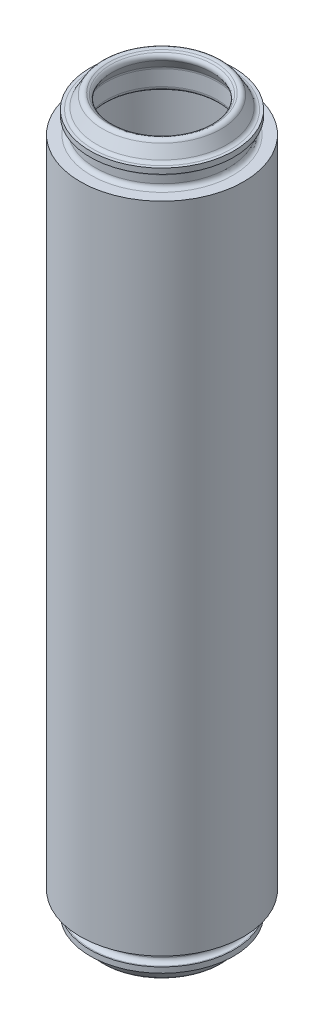
from build123d import *

# Parameters (mm, degrees)
SKETCH1_R           = 7.5
BOSS_EXTRUDE1_DEPTH = 30
SKETCH2_R           = 6.5
CUT_EXTRUDE1_DEPTH  = 8.5


with BuildPart() as part:
    # Sketch1 → Boss-Extrude1 (new body)
    with BuildSketch(Plane(origin=(0, 0, 0), x_dir=(1, 0, 0), z_dir=(0, 1, 0))):
        with Locations(Location((0, 0, 0), (0, 0, 270))):
            Circle(SKETCH1_R)
    boss_extrude1 = extrude(amount=BOSS_EXTRUDE1_DEPTH)

    # Sketch2 → Cut-Extrude1 (cut)
    with BuildSketch(Plane(origin=(0, 30, 0), x_dir=(1, 0, 0), z_dir=(0, 1, 0))):
        with Locations(Location((0, 0, 0), (0, 0, 270))):
            Circle(SKETCH2_R)
    cut_extrude1 = extrude(amount=-CUT_EXTRUDE1_DEPTH, mode=Mode.SUBTRACT)

    # Sketch3 → Revolve1 (revolve)
    with BuildSketch(Plane.XY, mode=Mode.PRIVATE) as revolve1_sk:
        with BuildLine():
            Line((-7, 30), (-6.5, 30))
            ThreePointArc((-6.5, 30), (-6.217157288, 30.117157288), (-6.1, 30.4))
            Line((-6.1, 30.4), (-6.1, 31.1))
            ThreePointArc((-6.1, 31.1), (-6.217157288, 31.382842712), (-6.5, 31.5))
            Line((-6.5, 31.5), (-6.6, 31.5))
            Line((-6.6, 31.5), (-6.6, 32))
            Line((-6.6, 32), (-6.330940108, 32))
            ThreePointArc((-6.330940108, 32), (-6.130940108, 32.053589838), (-5.984529946, 32.2))
            Line((-5.984529946, 32.2), (-5.433974596, 33.153589838))
            ThreePointArc((-5.433974596, 33.153589838), (-5.191092053, 33.339960169), (-4.887564435, 33.3))
            Line((-4.887564435, 33.3), (-4.714359354, 33.2))
            ThreePointArc((-4.714359354, 33.2), (-4.527989023, 32.957117457), (-4.567949192, 32.653589838))
            Line((-4.567949192, 32.653589838), (-5.046410162, 31.824871131))
            ThreePointArc((-5.046410162, 31.824871131), (-5.086370331, 31.728398749), (-5.1, 31.624871131))
            Line((-5.1, 31.624871131), (-5.1, 30.205847158))
            ThreePointArc((-5.1, 30.205847158), (-5.144332943, 30.022814526), (-5.267504723, 29.88035377))
            Line((-5.267504723, 29.88035377), (-6.5, 29))
            Line((-6.5, 29), (-7, 29))
            Line((-7, 29), (-7, 30))
        make_face()
    revolve1 = revolve(revolve1_sk.sketch.rotate(Axis((0, 21.5, 0), (0, 1, 0)), 270), axis=Axis((0, 21.5, 0), (0, 1, 0)))

    # Mirror1: Boss-Extrude1, Cut-Extrude1, Revolve1 across plane
    add(boss_extrude1.mirror(Plane.ZX))
    add(cut_extrude1.mirror(Plane.ZX), mode=Mode.SUBTRACT)
    add(revolve1.mirror(Plane.ZX))


solid = part.part
